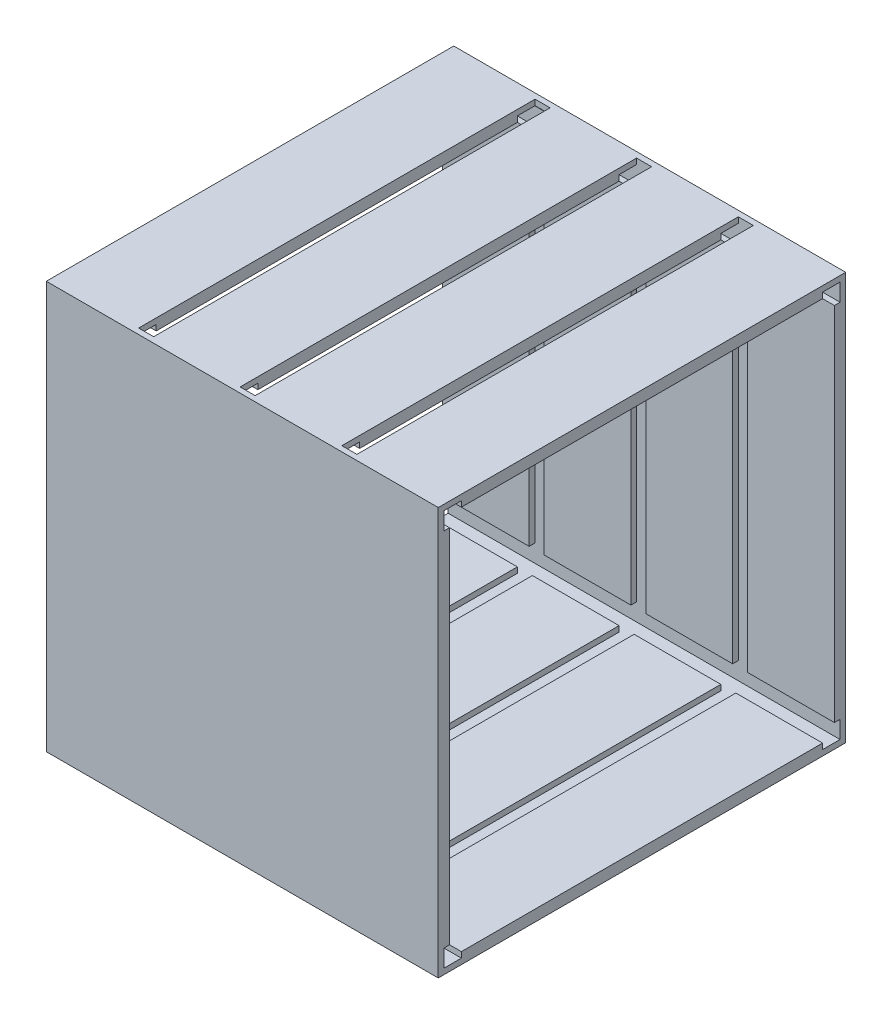
from build123d import *

# Parameters (mm, degrees)
SKETCH1_W            = 688.1
SKETCH1_H            = 688.1
SKETCH1_W_2          = 650
SKETCH1_H_2          = 650
BOSS_EXTRUDE1_DEPTH  = 661.9
SKETCH3_W            = 25.4
SKETCH3_H            = 650
CUT_EXTRUDE1_DEPTH   = 9.525
SKETCH4_W            = 25.4
SKETCH4_H            = 669.5
SKETCH4_H_2          = 669.05
CUT_EXTRUDE3_DEPTH   = 9.525
SKETCH6_W            = 25.4
SKETCH6_H            = 669.5
CUT_EXTRUDE4_DEPTH   = 9.525
CUT_EXTRUDE5_DEPTH   = 700
MIRROR6_COPY_1_DEPTH = 700


with BuildPart() as part:
    # Sketch1 → Boss-Extrude1 (new body)
    with BuildSketch(Plane(origin=(0, 0, 0), x_dir=(0, 0, -1), z_dir=(1, 0, 0))):
        with Locations((344.05, 344.05)):
            Rectangle(SKETCH1_W, SKETCH1_H)
        with Locations((344.05, 344.05)):
            Rectangle(SKETCH1_W_2, SKETCH1_H_2, mode=Mode.SUBTRACT)
    extrude(amount=BOSS_EXTRUDE1_DEPTH)

    # Sketch3 → Cut-Extrude1 (cut)
    with BuildSketch(Plane.XY.offset(-669.05)):
        with Locations((159.125, 344.05)):
            Rectangle(SKETCH3_W, SKETCH3_H)
        with Locations((330.95, 344.05)):
            Rectangle(SKETCH3_W, SKETCH3_H)
        with Locations((502.775, 344.05)):
            Rectangle(SKETCH3_W, SKETCH3_H)
    cut_extrude1 = extrude(amount=-CUT_EXTRUDE1_DEPTH, mode=Mode.SUBTRACT)

    # Mirror2: Cut-Extrude1 across plane
    add(cut_extrude1.mirror(Plane(origin=(0, 0, -344.05), x_dir=(1, 0, 0), z_dir=(0, 0, -1))), mode=Mode.SUBTRACT)

    # Sketch4 → Cut-Extrude3 (cut)
    with BuildSketch(Plane(origin=(0, 19.05, 0), x_dir=(1, 0, 0), z_dir=(0, 1, 0))):
        with Locations((159.125, 343.825)):
            Rectangle(SKETCH4_W, SKETCH4_H)
        with Locations((330.95, 343.825)):
            Rectangle(SKETCH4_W, SKETCH4_H)
        with Locations((502.775, 344.05)):
            Rectangle(SKETCH4_W, SKETCH4_H_2)
    cut_extrude3 = extrude(amount=-CUT_EXTRUDE3_DEPTH, mode=Mode.SUBTRACT)

    # Mirror4: Cut-Extrude3 across plane
    add(cut_extrude3.mirror(Plane.ZX.offset(344.05)), mode=Mode.SUBTRACT)

    # Sketch6 → Cut-Extrude4 (cut)
    with BuildSketch(Plane(origin=(0, 688.1, 0), x_dir=(1, 0, 0), z_dir=(0, 1, 0))):
        with Locations((159.125, 344.275)):
            Rectangle(SKETCH6_W, SKETCH6_H)
        with Locations((330.95, 343.825)):
            Rectangle(SKETCH6_W, SKETCH6_H)
        with Locations((502.775, 343.825)):
            Rectangle(SKETCH6_W, SKETCH6_H)
    extrude(amount=-CUT_EXTRUDE4_DEPTH, mode=Mode.SUBTRACT)

    # Sketch7 → Cut-Extrude5 (cut)
    with BuildSketch(Plane.ZY):
        Polygon((-19.05, 39.05), (-9.525, 39.05), (-9.525, 9.525), (-39.05, 9.525), (-39.05, 19.05), (-19.05, 19.05), align=None)
    cut_extrude5 = extrude(amount=-CUT_EXTRUDE5_DEPTH, mode=Mode.SUBTRACT)

    # Mirror5: Cut-Extrude5 across plane
    add(cut_extrude5.mirror(Plane(origin=(0, 0, -344.05), x_dir=(1, 0, 0), z_dir=(0, 0, -1))), mode=Mode.SUBTRACT)

    # Mirror6: Cut-Extrude5 across plane
    add(cut_extrude5.mirror(Plane.ZX.offset(344.05)), mode=Mode.SUBTRACT)

    # Mirror6 copy 1 sketch → Mirror6 copy 1 (cut)
    with BuildSketch(Plane(origin=(0, 688.1, -688.1), x_dir=(0, 0, -1), z_dir=(-1, 0, 0))):
        Polygon((-19.05, 39.05), (-9.525, 39.05), (-9.525, 9.525), (-39.05, 9.525), (-39.05, 19.05), (-19.05, 19.05), align=None)
    extrude(amount=-MIRROR6_COPY_1_DEPTH, mode=Mode.SUBTRACT)


solid = part.part
